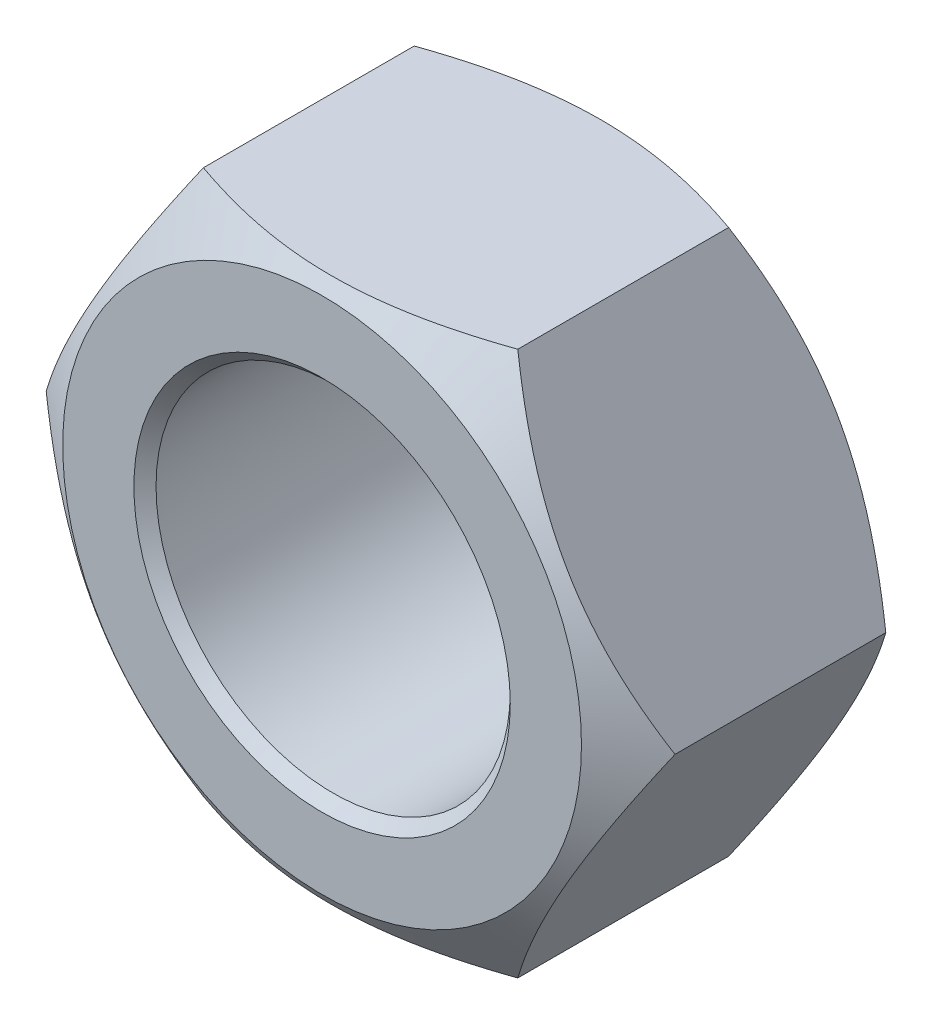
from build123d import *

# Parameters (mm, degrees)
SKETCH1_R           = 4
BOSS_EXTRUDE1_DEPTH = 6.5
CHAMFER1_SIZE       = 0.25


with BuildPart() as part:
    # Sketch1 → Boss-Extrude1 (new body)
    with BuildSketch(Plane.XY):
        Polygon((7.1, 0), (3.55, 6.148780367), (-3.55, 6.148780367), (-7.1, 0), (-3.55, -6.148780367), (3.55, -6.148780367), align=None)
        with Locations(Location((0, 0, 0), (0, 0, 180))):
            Circle(SKETCH1_R, mode=Mode.SUBTRACT)
    extrude(amount=BOSS_EXTRUDE1_DEPTH)

    # Chamfer1
    chamfer1_edges = [part.edges().sort_by_distance(p)[0] for p in [
        (4, 0, 0),
        (4, 0, 6.5),
    ]]
    chamfer(chamfer1_edges, length=CHAMFER1_SIZE)

    # Sketch3 → Cut-Revolve1 (revolve, cut)
    with BuildSketch(Plane(origin=(0, 0, 0), x_dir=(1, 0, 0), z_dir=(0, 1, 0)), mode=Mode.PRIVATE) as cut_revolve1_sk:
        Polygon((-1, -7.5), (-4.429629983, -7.5), (-8, -5), (-8, -1.5), (-4.429629983, 1), (-1, 1), (-1, 1.925478013), (-9.540810572, 1.925478013), (-9.540810572, -8.900626742), (-1, -8.900626742), align=None)
    revolve(cut_revolve1_sk.sketch.rotate(Axis((0, 0, 7.5), (0, 0, -1)), 180), axis=Axis((0, 0, 7.5), (0, 0, -1)), mode=Mode.SUBTRACT)


solid = part.part
